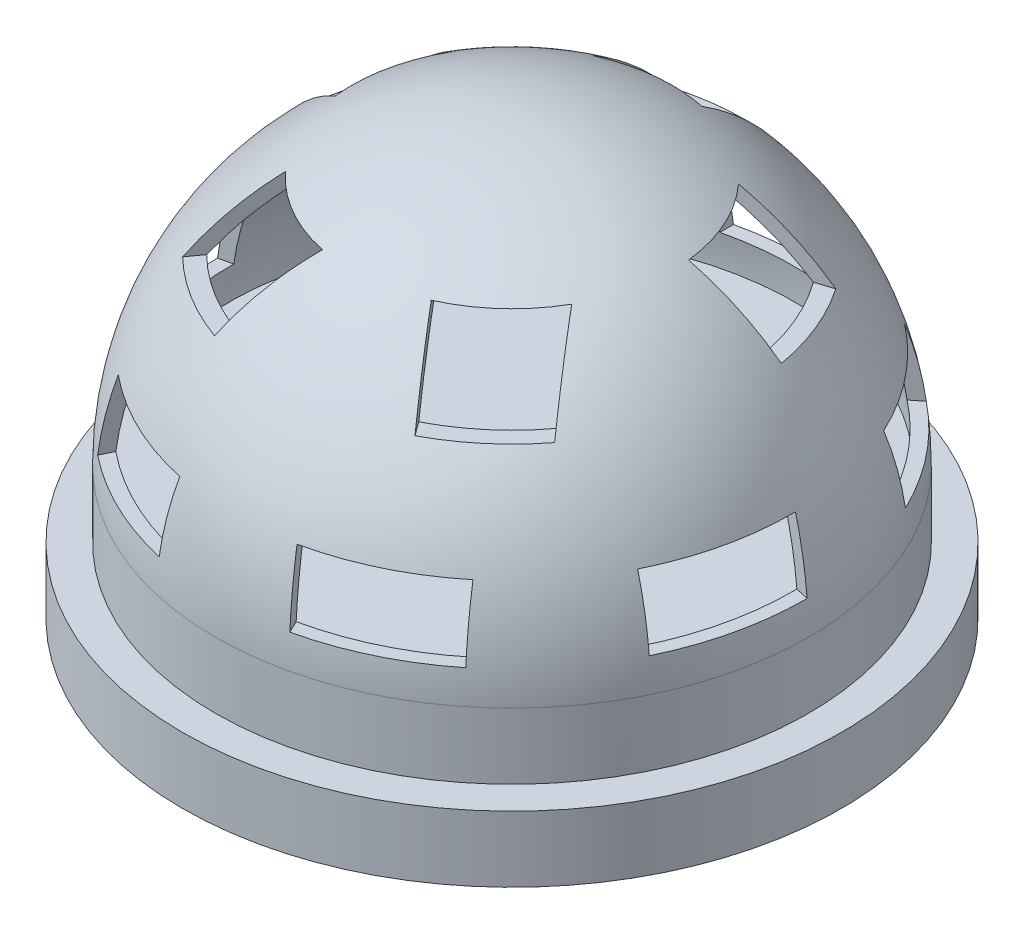
from build123d import *

# Parameters (mm, degrees)
SCHIZZO1_R                   = 50
ESTRUSIONE_ESTRUSIONE1_DEPTH = 10
SCHIZZO2_R                   = 45
ESTRUSIONE_ESTRUSIONE2_DEPTH = 10
SCHIZZO14_W                  = 20
SCHIZZO14_H                  = 10
TAGLIO_ESTRUSIONE2_DEPTH     = 53
RIPETIZIONECIRCOLARE6_COUNT  = 7
SCHIZZO17_W                  = 15
SCHIZZO17_H                  = 10
TAGLIO_ESTRUSIONE3_DEPTH     = 53
RIPETIZIONECIRCOLARE7_COUNT  = 5


with BuildPart() as part:
    # Schizzo1 → Estrusione-Estrusione1 (new body)
    with BuildSketch(Plane(origin=(0, 0, 0), x_dir=(1, 0, 0), z_dir=(0, 1, 0))):
        with Locations(Location((0, 0, 0), (0, 0, 270))):
            Circle(SCHIZZO1_R)
    extrude(amount=ESTRUSIONE_ESTRUSIONE1_DEPTH)

    # Schizzo2 → Estrusione-Estrusione2 (add)
    with BuildSketch(Plane(origin=(0, 10, 0), x_dir=(1, 0, 0), z_dir=(0, 1, 0))):
        with Locations(Location((0, 0, 0), (0, 0, 270))):
            Circle(SCHIZZO2_R)
    extrude(amount=ESTRUSIONE_ESTRUSIONE2_DEPTH)

    # Schizzo6 → Rivoluzione9 (revolve)
    with BuildSketch(Plane(origin=(0, 0, 0), x_dir=(0, 0, -1), z_dir=(1, 0, 0)), mode=Mode.PRIVATE) as rivoluzione9_sk:
        with BuildLine():
            Line((0, 65), (0, 63))
            ThreePointArc((0, 63), (-30.405591591, 50.405591591), (-43, 20))
            Line((-43, 20), (-45, 20))
            ThreePointArc((-45, 20), (-31.819805153, 51.819805153), (0, 65))
        make_face()
    revolve(rivoluzione9_sk.sketch.rotate(Axis((0, 119.686269666, 0), (0, -1, 0)), 180), axis=Axis((0, 119.686269666, 0), (0, -1, 0)))

    # Schizzo14 → Taglio-Estrusione2 (cut)
    with BuildSketch(Plane.XY):
        with Locations((0, 29.930993036)):
            Rectangle(SCHIZZO14_W, SCHIZZO14_H)
    taglio_estrusione2 = extrude(amount=-TAGLIO_ESTRUSIONE2_DEPTH, mode=Mode.SUBTRACT)

    # RipetizioneCircolare6: Taglio-Estrusione2 ×7 about axis
    ripetizionecircolare6_axis = Axis((0, 0, 0), (0, 1, 0))
    for i in range(1, RIPETIZIONECIRCOLARE6_COUNT):
        add(taglio_estrusione2.rotate(ripetizionecircolare6_axis, i * 360 / RIPETIZIONECIRCOLARE6_COUNT), mode=Mode.SUBTRACT)

    # Schizzo17 → Taglio-Estrusione3 (cut)
    with BuildSketch(Plane.XY):
        with Locations((-2.5, 52.858470441)):
            Rectangle(SCHIZZO17_W, SCHIZZO17_H)
    taglio_estrusione3 = extrude(amount=-TAGLIO_ESTRUSIONE3_DEPTH, mode=Mode.SUBTRACT)

    # RipetizioneCircolare7: Taglio-Estrusione3 ×5 about axis
    ripetizionecircolare7_axis = Axis((0, 0, 0), (0, 1, 0))
    for i in range(1, RIPETIZIONECIRCOLARE7_COUNT):
        add(taglio_estrusione3.rotate(ripetizionecircolare7_axis, i * 360 / RIPETIZIONECIRCOLARE7_COUNT), mode=Mode.SUBTRACT)


solid = part.part
